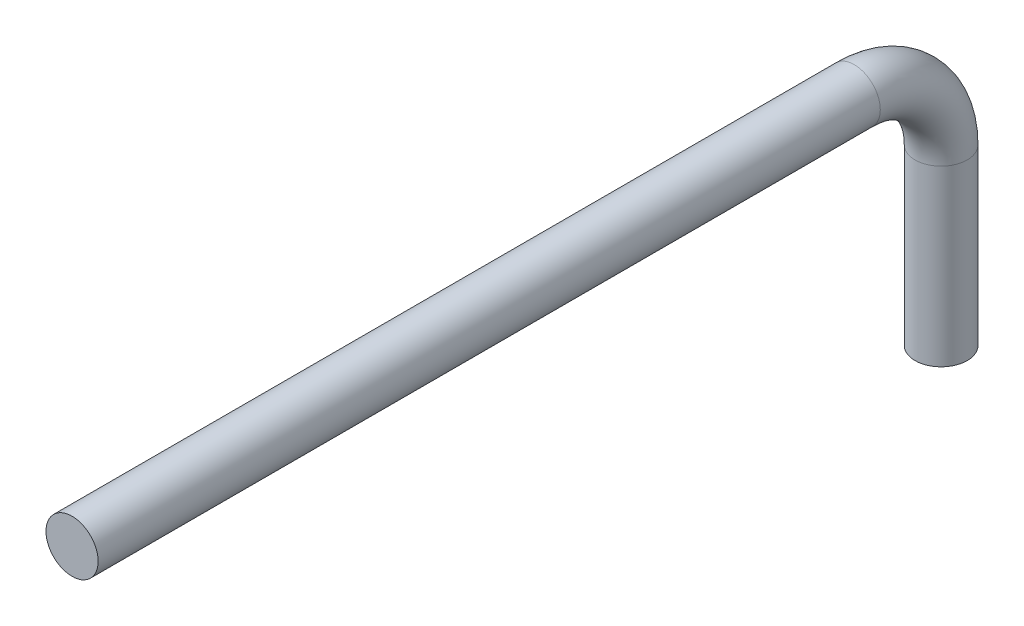
from build123d import *

# Parameters (mm, degrees)
SKETCH1_R = 3


with BuildPart() as part:
    # Sweep1: sweep along a curve in space
    with BuildLine() as sweep1_path:
        Line((0, 0, 0), (0, 20, 0))
        ThreePointArc((0, 30, 10), (0, 27.071067812, 2.928932188), (0, 20, 0))
        Line((0, 30, 10), (0, 30, 100))
    # Sketch1 → Sweep1 (sweep)
    with BuildSketch(Plane(origin=(0, 0, 0), x_dir=(-1, 0, 0), z_dir=(0, 1, 0))):
        Circle(SKETCH1_R)
    sweep(path=sweep1_path.line)


solid = part.part
